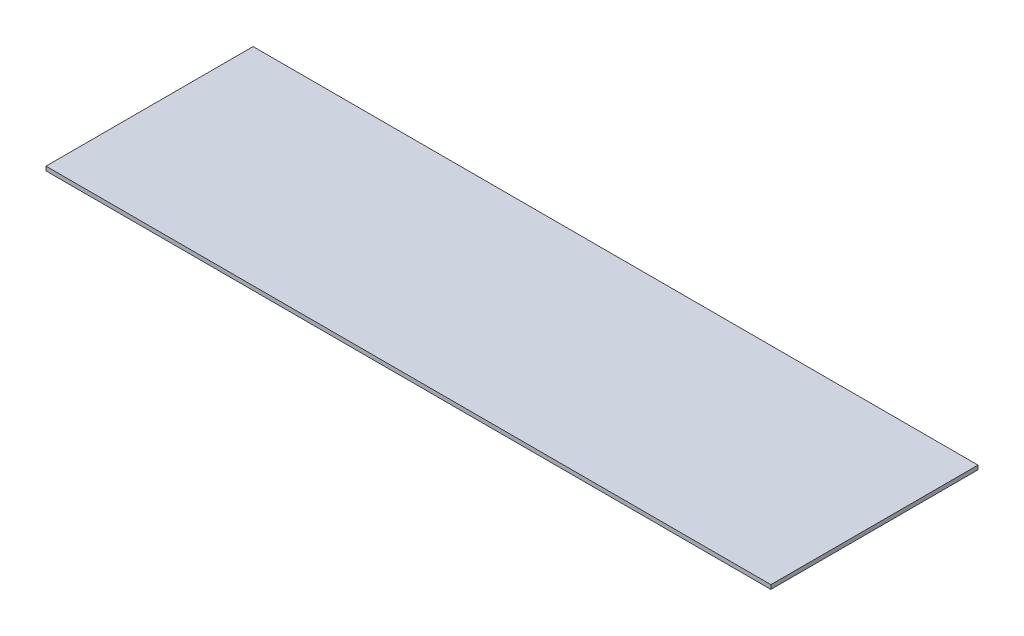
from build123d import *

# Parameters (mm, degrees)
SKETCH1_W           = 350
SKETCH1_H           = 100
BOSS_EXTRUDE1_DEPTH = 2


with BuildPart() as part:
    # Sketch1 → Boss-Extrude1 (new body)
    with BuildSketch(Plane(origin=(0, 0, 0), x_dir=(1, 0, 0), z_dir=(0, 1, 0))):
        with Locations((175, -50)):
            Rectangle(SKETCH1_W, SKETCH1_H)
    extrude(amount=BOSS_EXTRUDE1_DEPTH)


solid = part.part
